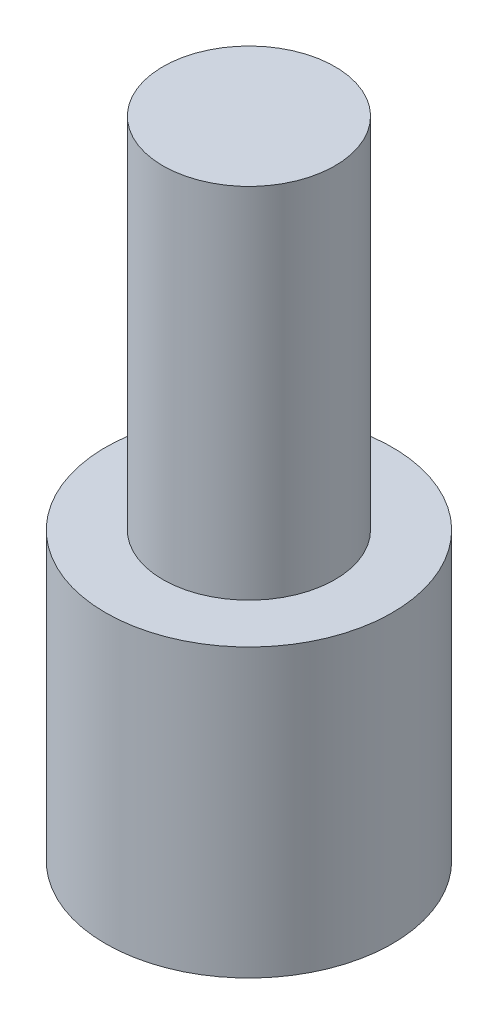
from build123d import *

# Parameters (mm, degrees)
SKETCH1_R           = 5
BOSS_EXTRUDE1_DEPTH = 10
SKETCH2_R           = 2.5
CUT_EXTRUDE1_DEPTH  = 8
SKETCH3_R           = 3
BOSS_EXTRUDE2_DEPTH = 12.5


with BuildPart() as part:
    # Sketch1 → Boss-Extrude1 (new body)
    with BuildSketch(Plane(origin=(0, 0, 0), x_dir=(1, 0, 0), z_dir=(0, 1, 0))):
        with Locations(Location((0, 0, 0), (0, 0, 270))):
            Circle(SKETCH1_R)
    extrude(amount=BOSS_EXTRUDE1_DEPTH)

    # Sketch2 → Cut-Extrude1 (cut)
    with BuildSketch(Plane.XZ):
        with Locations(Location((0, 0, 0), (0, 0, 270))):
            Circle(SKETCH2_R)
    extrude(amount=-CUT_EXTRUDE1_DEPTH, mode=Mode.SUBTRACT)

    # Sketch3 → Boss-Extrude2 (add)
    with BuildSketch(Plane(origin=(0, 10, 0), x_dir=(1, 0, 0), z_dir=(0, 1, 0))):
        with Locations(Location((0, 0, 0), (0, 0, 270))):
            Circle(SKETCH3_R)
    extrude(amount=BOSS_EXTRUDE2_DEPTH)


solid = part.part
